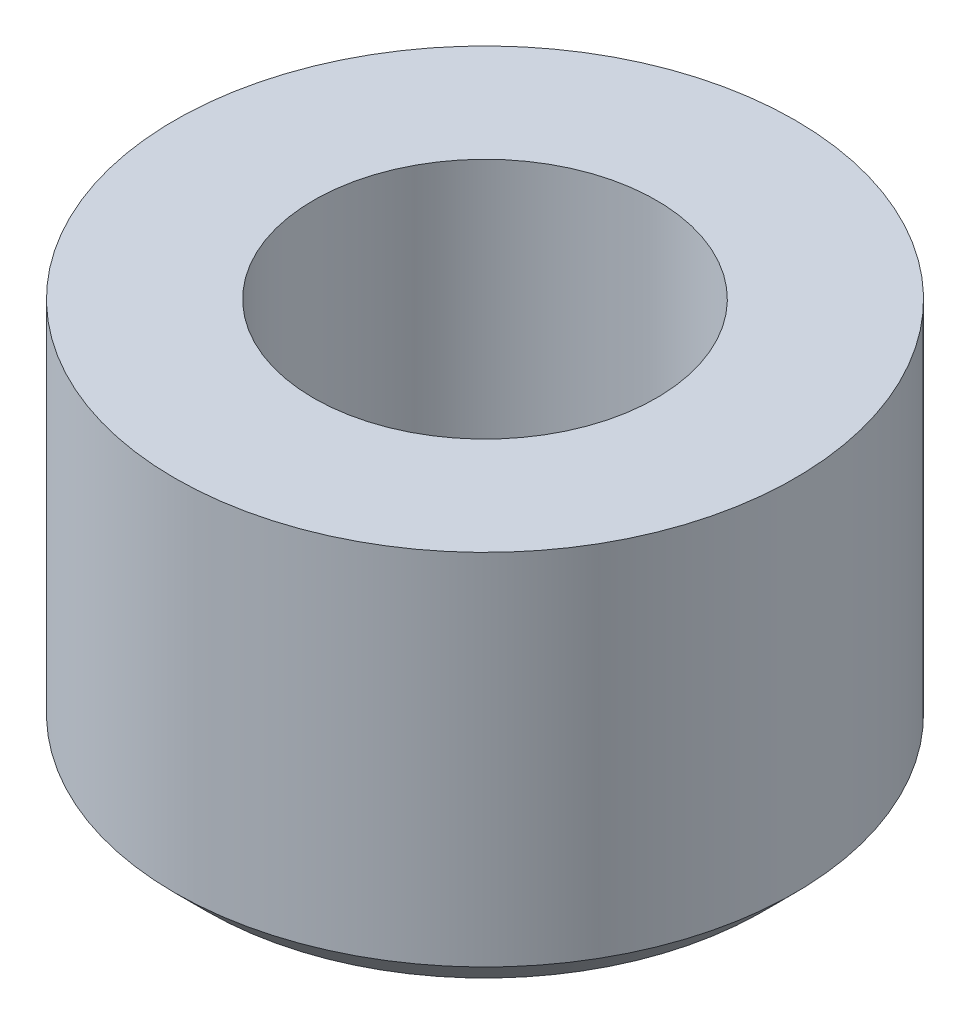
from build123d import *

# Parameters (mm, degrees)
SKETCH1_R           = 3.8
SKETCH1_R_2         = 2.1
BOSS_EXTRUDE1_DEPTH = 4.8
CHAMFER1_SIZE       = 0.4
CHAMFER1_SIZE2      = 0.399999869


with BuildPart() as part:
    # Sketch1 → Boss-Extrude1 (new body)
    with BuildSketch(Plane(origin=(0, 0, 0), x_dir=(1, 0, 0), z_dir=(0, 1, 0))):
        with Locations(Location((0, 0, 0), (0, 0, 270))):
            Circle(SKETCH1_R)
        with Locations(Location((0, 0, 0), (0, 0, 270))):
            Circle(SKETCH1_R_2, mode=Mode.SUBTRACT)
    extrude(amount=BOSS_EXTRUDE1_DEPTH)

    # Chamfer1
    chamfer1_edges = [part.edges().sort_by_distance(p)[0] for p in [
        (0, 0, -3.8),
    ]]
    chamfer1_side = [part.faces().sort_by_distance(p)[0] for p in [
        (0, 2.4, -3.8),
    ]]
    chamfer(chamfer1_edges, length=CHAMFER1_SIZE, length2=CHAMFER1_SIZE2, reference=chamfer1_side[0])


solid = part.part
